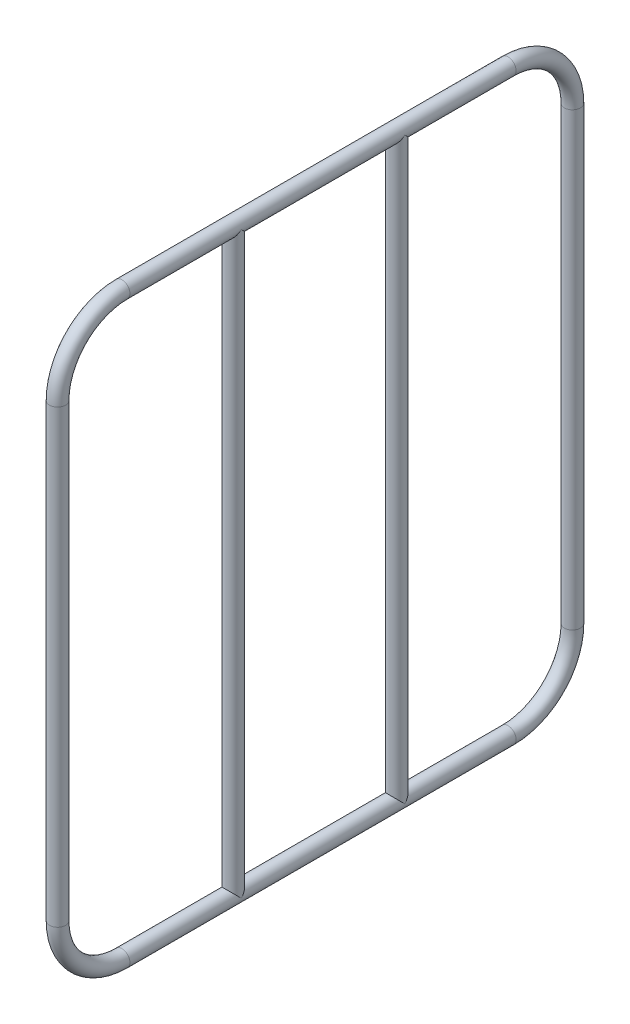
from build123d import *

# Parameters (mm, degrees)
SWEEP_THIN1_PROFILE_R   = 12.5
SWEEP_THIN1_PROFILE_R_2 = 10.5
SWEEP_THIN3_PROFILE_R   = 12.5
SWEEP_THIN3_PROFILE_R_2 = 10.5


with BuildPart() as part:
    # Sweep-Thin1: sweep along a path in Sketch1
    with BuildLine(Plane(origin=(0, 0, 0), x_dir=(0, 0, -1), z_dir=(1, 0, 0))) as sweep_thin1_path:
        Line((-400, 800), (-400, 100))
        ThreePointArc((-400, 100), (-370.710678119, 29.289321881), (-300, 0))
        Line((-300, 0), (300, 0))
        ThreePointArc((300, 0), (370.710678119, 29.289321881), (400, 100))
        Line((400, 100), (400, 800))
        ThreePointArc((400, 800), (370.710678119, 870.710678119), (300, 900))
        Line((300, 900), (-300, 900))
        ThreePointArc((-300, 900), (-370.710678119, 870.710678119), (-400, 800))
    # Sweep-Thin1 profile (on start of the path) → Sweep-Thin1 (sweep)
    with BuildSketch(Plane(origin=(0, 800, 400), x_dir=(0, 0, -1), z_dir=(0, -1, 0))):
        Circle(SWEEP_THIN1_PROFILE_R)
        Circle(SWEEP_THIN1_PROFILE_R_2, mode=Mode.SUBTRACT)
    sweep(path=sweep_thin1_path.line)

    # Sweep-Thin3: sweep along a path in Sketch27
    with BuildLine(Plane(origin=(0, 0, 0), x_dir=(0, 0, -1), z_dir=(1, 0, 0))) as sweep_thin3_path:
        Line((-127, 900), (127, 900))
        Line((127, 900), (127, 0))
        Line((127, 0), (-127, 0))
        Line((-127, 0), (-127, 900))
    # Sweep-Thin3 profile (on start of the path) → Sweep-Thin3 (sweep)
    with BuildSketch(Plane(origin=(0, 900, 127), x_dir=(-1, 0, 0), z_dir=(0, 0, -1))):
        Circle(SWEEP_THIN3_PROFILE_R)
        Circle(SWEEP_THIN3_PROFILE_R_2, mode=Mode.SUBTRACT)
    sweep(path=sweep_thin3_path.line, transition=Transition.RIGHT)


solid = part.part
